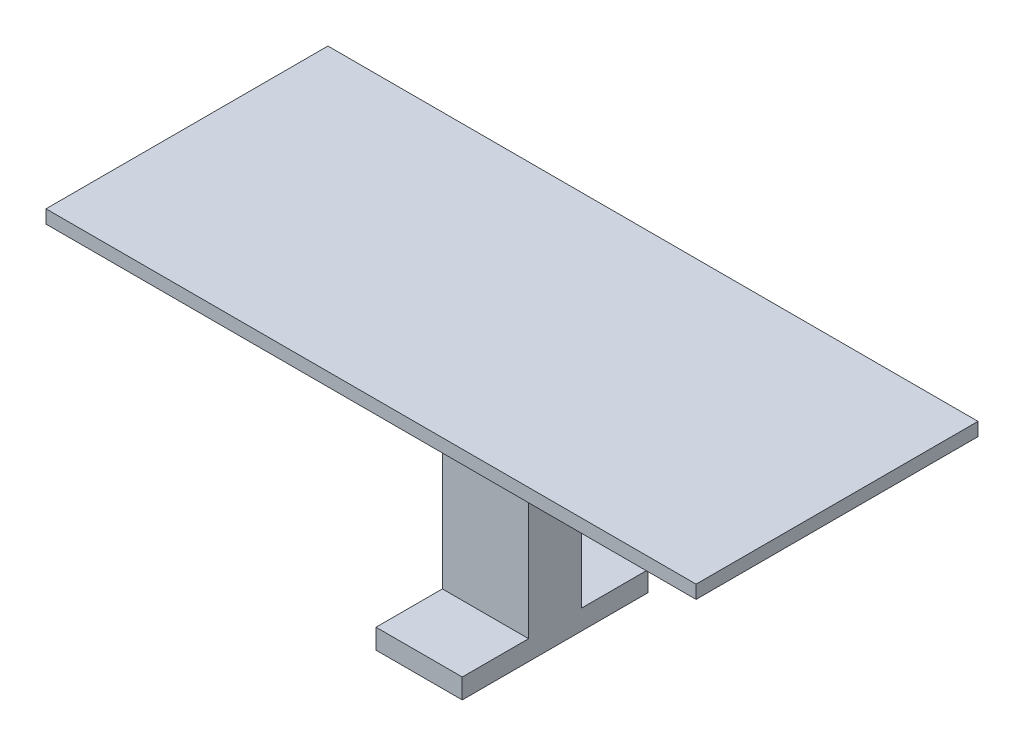
from build123d import *

# Parameters (mm, degrees)
SKETCH1_W           = 98
SKETCH1_H           = 42.5
BOSS_EXTRUDE1_DEPTH = 2
SKETCH2_W           = 13
SKETCH2_H           = 8
BOSS_EXTRUDE2_DEPTH = 35
SKETCH3_W           = 13
SKETCH3_H           = 28
BOSS_EXTRUDE3_DEPTH = 3


with BuildPart() as part:
    # Sketch1 → Boss-Extrude1 (new body)
    with BuildSketch(Plane(origin=(0, 0, 0), x_dir=(1, 0, 0), z_dir=(0, 1, 0))):
        Rectangle(SKETCH1_W, SKETCH1_H)
    extrude(amount=BOSS_EXTRUDE1_DEPTH)

    # Sketch2 → Boss-Extrude2 (add)
    with BuildSketch(Plane.XZ):
        Rectangle(SKETCH2_W, SKETCH2_H)
    extrude(amount=BOSS_EXTRUDE2_DEPTH)

    # Sketch3 → Boss-Extrude3 (add)
    with BuildSketch(Plane.XZ.offset(35)):
        Rectangle(SKETCH3_W, SKETCH3_H)
    extrude(amount=BOSS_EXTRUDE3_DEPTH)


solid = part.part
